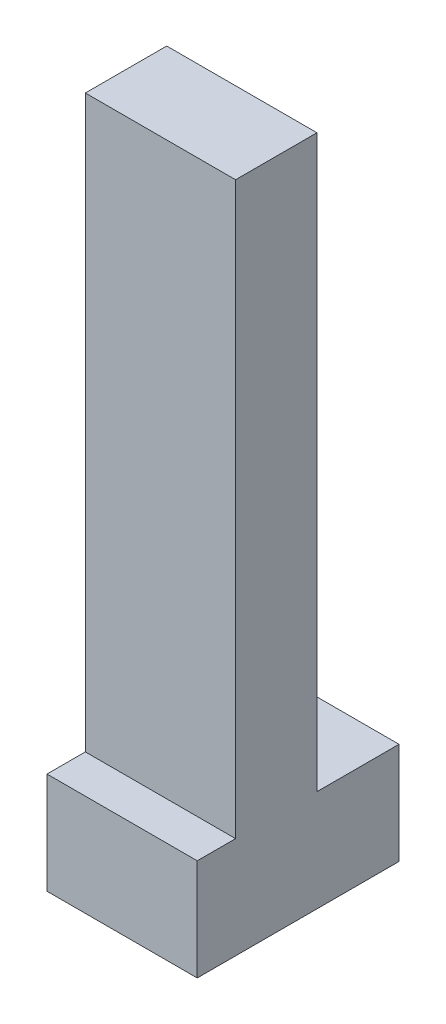
from build123d import *

# Parameters (mm, degrees)
BOSS_EXTRUDE2_DEPTH = 11


with BuildPart() as part:
    # Sketch3 → Boss-Extrude2 (new body)
    with BuildSketch(Plane(origin=(0, 0, 0), x_dir=(0, 0, -1), z_dir=(1, 0, 0))):
        Polygon((5.638912609, 30.116919614), (5.638912609, -11.662296531), (2.831869602, -11.662296531), (2.831869602, -19.095408607), (17.604123183, -19.095408607), (17.604123183, -11.662296531), (11.596654077, -11.662296531), (11.596654077, 30.116919614), align=None)
    extrude(amount=BOSS_EXTRUDE2_DEPTH)


solid = part.part
